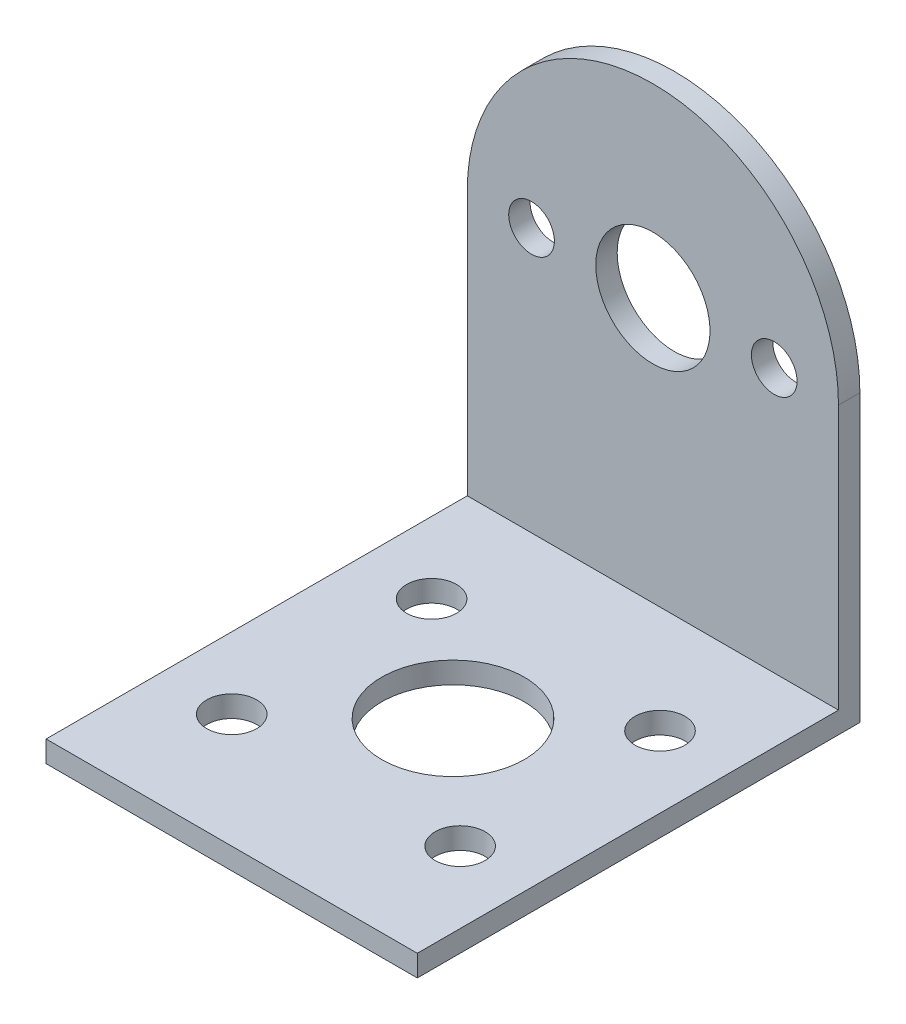
from build123d import *

# Parameters (mm, degrees)
SKETCH_1_W      = 26
SKETCH_1_H      = 31
SKETCH_1_R      = 5
SKETCH_1_R_2    = 1.75
EXTRUDE_1_DEPTH = 1.5
SKETCH_2_R      = 1.6
SKETCH_2_R_2    = 4
EXTRUDE_2_DEPTH = 1.5


with BuildPart() as part:
    # 草图1 → 凸台-拉伸1 (new body)
    with BuildSketch(Plane(origin=(0, 0, 0), x_dir=(1, 0, 0), z_dir=(0, 1, 0))):
        Rectangle(SKETCH_1_W, SKETCH_1_H)
        with Locations(Location((0, 0, 0), (0, 0, 270))):
            Circle(SKETCH_1_R, mode=Mode.SUBTRACT)
        with Locations(Location((-8, 6.5, 0), (0, 0, 270))):
            Circle(SKETCH_1_R_2, mode=Mode.SUBTRACT)
        with Locations(Location((8, 6.5, 0), (0, 0, 270))):
            Circle(SKETCH_1_R_2, mode=Mode.SUBTRACT)
        with Locations(Location((8, -7.5, 0), (0, 0, 270))):
            Circle(SKETCH_1_R_2, mode=Mode.SUBTRACT)
        with Locations(Location((-8, -7.5, 0), (0, 0, 270))):
            Circle(SKETCH_1_R_2, mode=Mode.SUBTRACT)
    extrude(amount=EXTRUDE_1_DEPTH)

    # 草图2 → 凸台-拉伸2 (add)
    with BuildSketch(Plane(origin=(0, 0, -15.5), x_dir=(-1, 0, 0), z_dir=(0, 0, -1))):
        with BuildLine():
            Line((-13, 20), (-13, 1.5))
            Line((-13, 1.5), (13, 1.5))
            Line((13, 1.5), (13, 20))
            ThreePointArc((13, 20), (0, 33), (-13, 20))
        make_face()
        with Locations((-8.5, 20)):
            Circle(SKETCH_2_R, mode=Mode.SUBTRACT)
        with Locations((0, 20)):
            Circle(SKETCH_2_R_2, mode=Mode.SUBTRACT)
        with Locations((8.5, 20)):
            Circle(SKETCH_2_R, mode=Mode.SUBTRACT)
    extrude(amount=-EXTRUDE_2_DEPTH)


solid = part.part
